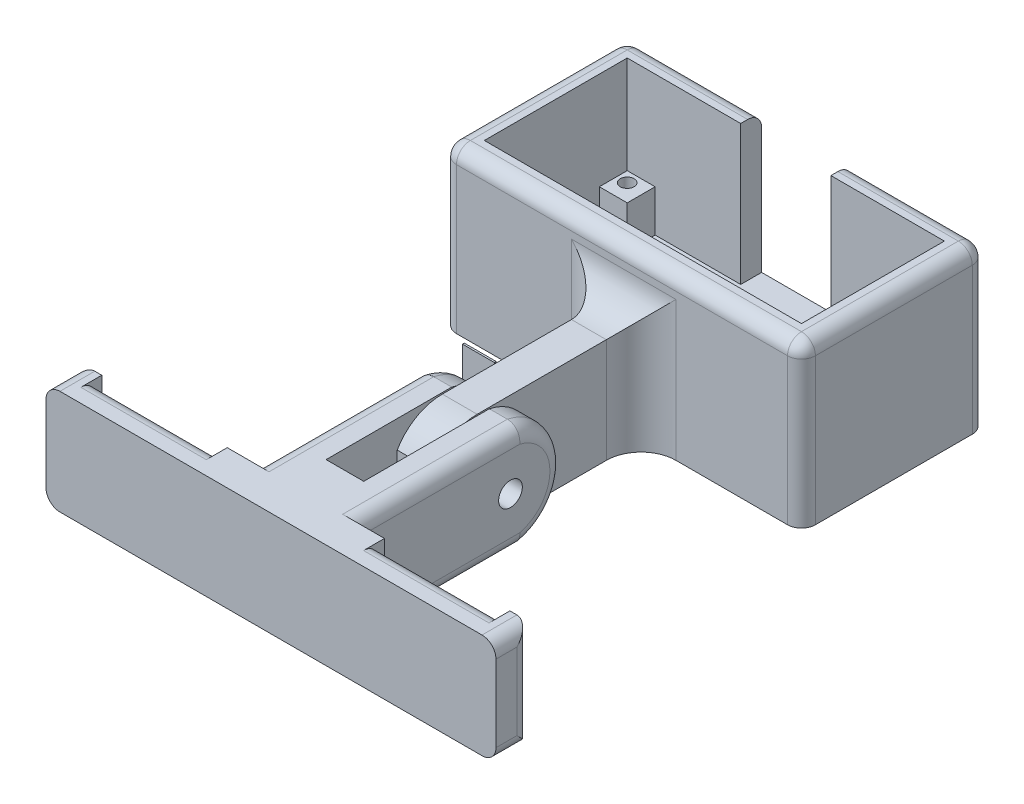
from build123d import *

# Parameters (mm, degrees)
EXTRUDE_1_DEPTH     = 20
SKETCH_1_3_W        = 4
SKETCH_1_3_H        = 4
SKETCH_1_3_R        = 1
EXTRUDE_2_DEPTH     = 6
SKETCH_1_4_W        = 51.5
SKETCH_1_4_H        = 26.5
EXTRUDE_3_DEPTH     = 3
FILLET_1_R          = 2
EXTRUDE_4_DEPTH     = 15
SKETCH_4_R          = 1.8
CUT_EXTRUDE_1_DEPTH = 5
FILLET_2_R          = 5
EXTRUDE_5_DEPTH     = 15
SKETCH_6_R          = 1.7
CUT_EXTRUDE_2_DEPTH = 15
FILLET_3_R          = 2


with BuildPart() as part:
    # Эскиз1 → Бобышка-Вытянуть1 (new body)
    with BuildSketch(Plane(origin=(0, 0, 0), x_dir=(1, 0, 0), z_dir=(0, 1, 0))):
        Polygon((-23, 6.5), (-23, 10.5), (-19, 10.5), (-6.718518259, 10.5), (-6.718518259, 13.5), (-26, 13.5), (-26, -13), (25.5, -13), (25.5, 13.5), (6.218518259, 13.5), (6.218518259, 10.5), (18.5, 10.5), (22.5, 10.5), (22.5, 6.5), (22.5, -6), (22.5, -10), (18.5, -10), (-19, -10), (-23, -10), (-23, -6), align=None)
    extrude(amount=EXTRUDE_1_DEPTH)

    # Эскиз1<3> → Бобышка-Вытянуть2 (add)
    # profile 1 of 4: a face of its own
    with BuildSketch(Plane(origin=(0, 0, 0), x_dir=(1, 0, 0), z_dir=(0, 1, 0))):
        with Locations((-21, 8.5)):
            Rectangle(SKETCH_1_3_W, SKETCH_1_3_H)
        with Locations((-21.5, 9)):
            Circle(SKETCH_1_3_R, mode=Mode.SUBTRACT)
    # profile 2 of 4: a face of its own
    with BuildSketch(Plane(origin=(0, 0, 0), x_dir=(1, 0, 0), z_dir=(0, 1, 0))):
        with Locations((-21, -8)):
            Rectangle(SKETCH_1_3_W, SKETCH_1_3_H)
        with Locations((-21.5, -8.5)):
            Circle(SKETCH_1_3_R, mode=Mode.SUBTRACT)
    # profile 3 of 4: a face of its own
    with BuildSketch(Plane(origin=(0, 0, 0), x_dir=(1, 0, 0), z_dir=(0, 1, 0))):
        with Locations((20.5, 8.5)):
            Rectangle(SKETCH_1_3_W, SKETCH_1_3_H)
        with Locations((21, 9)):
            Circle(SKETCH_1_3_R, mode=Mode.SUBTRACT)
    # profile 4 of 4: a face of its own
    with BuildSketch(Plane(origin=(0, 0, 0), x_dir=(1, 0, 0), z_dir=(0, 1, 0))):
        with Locations((20.5, -8)):
            Rectangle(SKETCH_1_3_W, SKETCH_1_3_H)
        with Locations((21, -8.5)):
            Circle(SKETCH_1_3_R, mode=Mode.SUBTRACT)
    extrude(amount=EXTRUDE_2_DEPTH)

    # Эскиз1<4> → Бобышка-Вытянуть3 (add)
    with BuildSketch(Plane(origin=(0, 0, 0), x_dir=(1, 0, 0), z_dir=(0, 1, 0))):
        with Locations((-0.25, 0.25)):
            Rectangle(SKETCH_1_4_W, SKETCH_1_4_H)
    extrude(amount=-EXTRUDE_3_DEPTH)

    # Скругление1
    fillet_1_edges = [part.edges().sort_by_distance(p)[0] for p in [
        (-26, 20, -0.25),
        (-16.359259129, 20, -13.5),
        (15.859259129, 20, -13.5),
        (25.5, 20, -0.25),
        (-0.25, 20, 13),
        (-26, 8.5, 13),
        (-26, 8.5, -13.5),
        (25.5, 8.5, -13.5),
        (25.5, 8.5, 13),
    ]]
    fillet(fillet_1_edges, radius=FILLET_1_R)

    # Эскиз3 → Бобышка-Вытянуть4 (add)
    with BuildSketch(Plane.XZ.offset(3)):
        Polygon((2.5, 13), (2.5, 43), (0, 43), (-2.5, 43), (-2.5, 13), align=None)
    extrude(amount=-EXTRUDE_4_DEPTH)

    # Эскиз4 → Вырез-Вытянуть1 (cut)
    with BuildSketch(Plane.ZY.offset(2.5)):
        with Locations((36.52553923, 4.5)):
            Circle(SKETCH_4_R)
        with BuildLine():
            ThreePointArc((36.52553923, 12), (40.257657608, 11.00548172), (43, 8.285677977))
            Line((43, 8.285677977), (43, 12))
            Line((43, 12), (36.52553923, 12))
        make_face()
        with BuildLine():
            Line((43, -3), (43, 0.714322023))
            ThreePointArc((43, 0.714322023), (40.257657608, -2.00548172), (36.52553923, -3))
            Line((36.52553923, -3), (43, -3))
        make_face()
    extrude(amount=-CUT_EXTRUDE_1_DEPTH, mode=Mode.SUBTRACT)

    # Скругление2
    fillet_2_edges = [part.edges().sort_by_distance(p)[0] for p in [
        (0, 12, 13),
        (2.5, 4.5, 13),
        (-2.5, 4.5, 13),
    ]]
    fillet(fillet_2_edges, radius=FILLET_2_R)


with BuildPart() as body_2:
    # Эскиз5 → Бобышка-Вытянуть5 (new body)
    with BuildSketch(Plane.XZ.offset(3)):
        Polygon((2.7, 53), (-2.7, 53), (-2.7, 28.606863908), (-7.277487258, 28.606863908), (-7.277487258, 58.606863908), (-11.277487258, 58.606863908), (-11.277487258, 59.606863908), (-29.277487258, 59.606863908), (-29.277487258, 58.606863908), (-32.277487258, 58.606863908), (-32.277487258, 63.606863908), (32.277487258, 63.606863908), (32.277487258, 58.606863908), (29.277487258, 58.606863908), (29.277487258, 59.606863908), (11.277487258, 59.606863908), (11.277487258, 58.606863908), (7.277487258, 58.606863908), (7.277487258, 28.867707957), (2.7, 28.867707957), align=None)
    extrude(amount=-EXTRUDE_5_DEPTH)

    # Эскиз6 → Вырез-Вытянуть2 (cut)
    with BuildSketch(Plane(origin=(7.277487258, 0, 0), x_dir=(0, 0, -1), z_dir=(1, 0, 0))):
        with Locations((-36.52553923, 4.5)):
            Circle(SKETCH_6_R)
        with BuildLine():
            ThreePointArc((-34.978807252, 12), (-30.588915934, 9.337239259), (-28.867707957, 4.5))
            Line((-28.867707957, 4.5), (-28.867707957, 12))
            Line((-28.867707957, 12), (-34.978807252, 12))
        make_face()
        with BuildLine():
            Line((-28.867707957, -3), (-28.867707957, 4.5))
            ThreePointArc((-28.867707957, 4.5), (-30.588915934, -0.337239259), (-34.978807252, -3))
            Line((-34.978807252, -3), (-28.867707957, -3))
        make_face()
    extrude(amount=-CUT_EXTRUDE_2_DEPTH, mode=Mode.SUBTRACT)


with BuildPart() as cut_extrude_2_piece_1:
    # of the separate pieces the step leaves, piece 1, a body of its own (cut_extrude_2_pieces)
    add(body_2.part.solids().sort_by_distance((2.7, -3, 53))[0])

    # Скругление3
    fillet_3_edges = [cut_extrude_2_piece_1.edges().sort_by_distance(p)[0] for p in [
        (32.277487258, 12, 61.106863908),
        (-32.277487258, 12, 61.106863908),
        (-32.277487258, -3, 61.106863908),
        (32.277487258, -3, 61.106863908),
        (20.277487258, -3, 59.606863908),
        (20.277487258, 12, 59.606863908),
        (-20.277487258, 12, 59.606863908),
        (-20.277487258, -3, 59.606863908),
        (-32.277487258, 4.5, 58.606863908),
        (32.277487258, 4.5, 58.606863908),
        (-7.277487258, 9.337239259, 30.588915934),
        (7.277487258, 4.5, 28.867707957),
        (-7.277487258, -3, 46.79283558),
        (7.277487258, -3, 46.79283558),
        (-7.277487258, 12, 46.79283558),
        (7.277487258, 12, 46.79283558),
    ]]
    fillet(fillet_3_edges, radius=FILLET_3_R)


with BuildPart() as cut_extrude_2_piece_2:
    # of the separate pieces the step leaves, piece 2, a body of its own (cut_extrude_2_pieces)
    add(body_2.part.solids().sort_by_distance((-2.7, -3, 28.867707957))[0])


solid = Compound([part.part, cut_extrude_2_piece_1.part, cut_extrude_2_piece_2.part])
